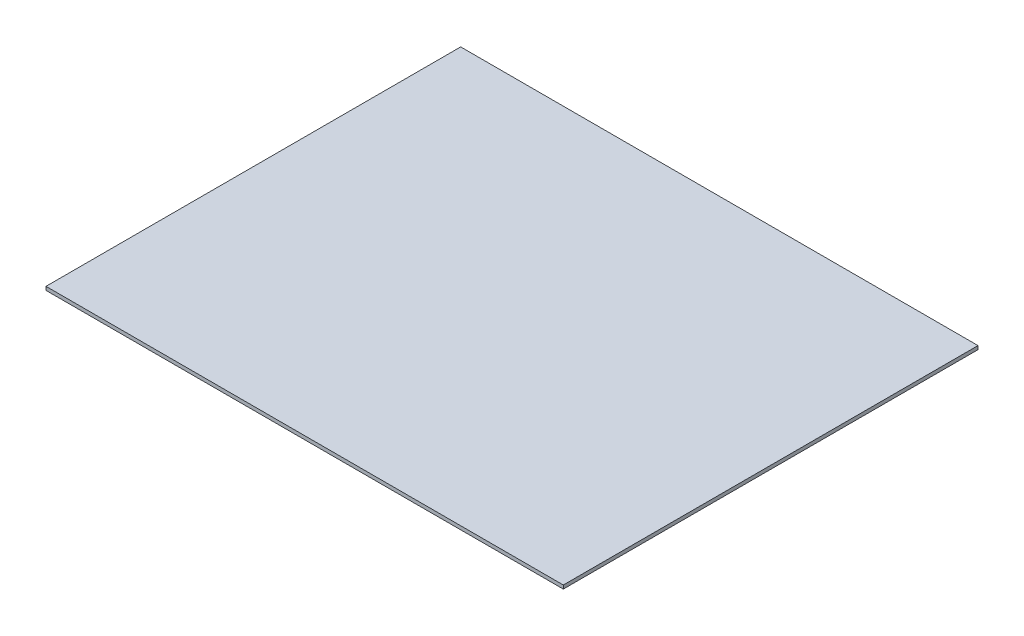
from build123d import *

# Parameters (mm, degrees)
SKETCH1_W           = 247
SKETCH1_H           = 198
BOSS_EXTRUDE1_DEPTH = 1.7


with BuildPart() as part:
    # Sketch1 → Boss-Extrude1 (new body)
    with BuildSketch(Plane(origin=(0, 0, 0), x_dir=(1, 0, 0), z_dir=(0, 1, 0))):
        Rectangle(SKETCH1_W, SKETCH1_H)
    extrude(amount=BOSS_EXTRUDE1_DEPTH)


solid = part.part
